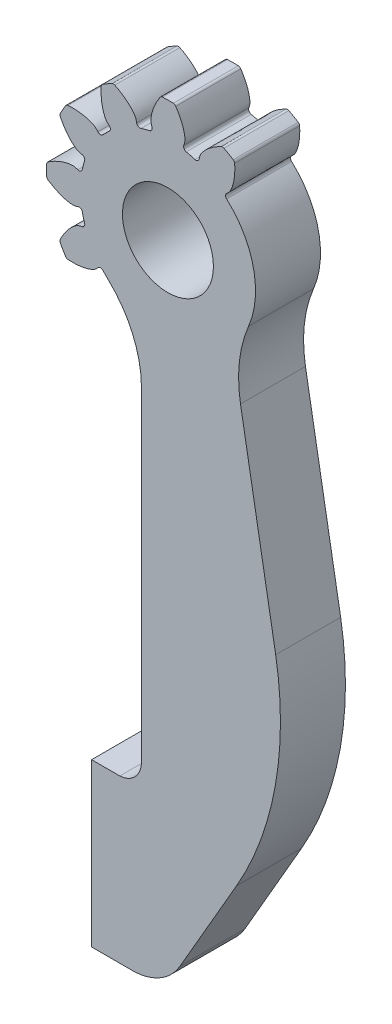
from build123d import *

# Parameters (mm, degrees)
ESQUISSE1_R        = 3.5
BOSS_EXTRU_1_DEPTH = 5


with BuildPart() as part:
    # Esquisse1 → Boss.-Extru.1 (new body)
    with BuildSketch(Plane.XY):
        with BuildLine():
            Line((5.90749079, 12.326495986), (8.616081221, -3.034683677))
            ThreePointArc((8.616081221, -3.034683677), (8.590159921, -11.751121376), (5.60083157, -19.938970549))
            Line((5.60083157, -19.938970549), (1.251100309, -27.472926092))
            ThreePointArc((1.251100309, -27.472926092), (-0.257489724, -28.999497571), (-2.320380522, -29.591735642))
            Line((-2.320380522, -29.591735642), (-5.550979445, -29.591735642))
            Line((-5.550979445, -29.591735642), (-5.550979445, -17.107469849))
            Line((-5.550979445, -17.107469849), (-3.378672956, -17.107469849))
            ThreePointArc((-3.378672956, -17.107469849), (-2.198535402, -16.559306042), (-1.717510344, -15.350247276))
            Line((-1.717510344, -15.350247276), (-1.717510344, 9.701342702))
            ThreePointArc((-1.717510344, 9.701342702), (-2.406894368, 12.879278297), (-4.28656883, 15.53283231))
            ThreePointArc((-4.28656883, 15.53283231), (-4.487711645, 15.729441192), (-4.68047629, 15.934271064))
            ThreePointArc((-4.68047629, 15.934271064), (-4.876370075, 16.017987907), (-5.067106513, 15.923106423))
            add(Edge.make_bspline(
                [(-5.067106513, 15.923106423), (-5.191748055, 15.767851436), (-5.299939447, 15.691192227), (-5.475656017, 15.590422708), (-5.555626682, 15.558374213), (-5.713073438, 15.497624167), (-5.788388923, 15.47301413), (-6.0298478, 15.402875582), (-6.188098951, 15.371946944), (-6.497686976, 15.326706478), (-6.647693738, 15.313871913), (-6.988957126, 15.299473797), (-7.17803548, 15.303219532), (-7.36420262, 15.315613466)],
                knots=[0, 0, 0, 0, 0.081187854, 0.081187854, 0.177126146, 0.177126146, 0.273064439, 0.273064439, 0.491378603, 0.491378603, 0.709692767, 0.709692767, 1, 1, 1, 1], degree=3))
            ThreePointArc((-7.36420262, 15.315613466), (-7.470552259, 15.348577609), (-7.550581738, 15.42598667))
            ThreePointArc((-7.550581738, 15.42598667), (-7.7655753, 15.779999439), (-7.96466262, 16.143195682))
            ThreePointArc((-7.96466262, 16.143195682), (-7.991686109, 16.251207764), (-7.967059097, 16.359791322))
            add(Edge.make_bspline(
                [(-7.967059097, 16.359791322), (-7.853279142, 16.591112501), (-7.721655826, 16.819817791), (-7.510149499, 17.119807091), (-7.454888608, 17.193639283), (-7.275603496, 17.41549623), (-7.144423881, 17.560666055), (-6.923836208, 17.748089252), (-6.871808058, 17.790229571), (-6.766452318, 17.865003383), (-6.719211083, 17.897766079), (-6.592860612, 17.966193375), (-6.508136026, 18.001557991), (-6.358828318, 18.034124778), (-6.326776228, 18.040093733), (-6.292406937, 18.045388672)],
                knots=[0, 0, 0, 0, 0.401379627, 0.401379627, 0.532597128, 0.532597128, 0.79503213, 0.79503213, 0.872293173, 0.872293173, 0.929035384, 0.929035384, 0.985777595, 0.985777595, 1, 1, 1, 1], degree=3))
            ThreePointArc((-6.292406937, 18.045388672), (-6.114868959, 18.163130556), (-6.089423008, 18.374637975))
            ThreePointArc((-6.089423008, 18.374637975), (-6.187238301, 18.705559184), (-6.267988424, 19.041052993))
            ThreePointArc((-6.267988424, 19.041052993), (-6.395778997, 19.211500799), (-6.608402339, 19.224699243))
            add(Edge.make_bspline(
                [(-6.608402339, 19.224699243), (-6.793972575, 19.152565251), (-6.925998674, 19.140272125), (-7.128558447, 19.140861446), (-7.213839323, 19.153091968), (-7.380567237, 19.179204263), (-7.458097378, 19.195549088), (-7.702276169, 19.255536761), (-7.85479, 19.307877348), (-8.145521318, 19.423491963), (-8.281848263, 19.487380282), (-8.58459009, 19.645542843), (-8.746463889, 19.743325926), (-8.901492413, 19.84714297)],
                knots=[0, 0, 0, 0, 0.081187854, 0.081187854, 0.177126147, 0.177126147, 0.27306444, 0.27306444, 0.491378597, 0.491378597, 0.709692753, 0.709692753, 1, 1, 1, 1], degree=3))
            ThreePointArc((-8.901492413, 19.84714297), (-8.977111822, 19.928865573), (-9.007714851, 20.035918521))
            ThreePointArc((-9.007714851, 20.035918521), (-9.016898352, 20.449999352), (-9.007714908, 20.864080185))
            ThreePointArc((-9.007714908, 20.864080185), (-8.977111894, 20.971133137), (-8.901492497, 21.05285575))
            add(Edge.make_bspline(
                [(-8.901492497, 21.05285575), (-8.687295576, 21.196295791), (-8.458953794, 21.328548725), (-8.125789291, 21.482593915), (-8.04101586, 21.518904025), (-7.774821925, 21.621395219), (-7.588632133, 21.681526168), (-7.303886006, 21.733545582), (-7.237758148, 21.744026093), (-7.109130488, 21.756104245), (-7.051837025, 21.760856956), (-6.908200633, 21.756941491), (-6.817144663, 21.745205847), (-6.671557002, 21.698755648), (-6.640814628, 21.687898878), (-6.608402509, 21.675299796)],
                knots=[0, 0, 0, 0, 0.401379628, 0.401379628, 0.532597129, 0.532597129, 0.795032131, 0.795032131, 0.872293174, 0.872293174, 0.929035391, 0.929035391, 0.985777608, 0.985777608, 1, 1, 1, 1], degree=3))
            ThreePointArc((-6.608402509, 21.675299796), (-6.395779169, 21.68849827), (-6.267988619, 21.858946092))
            ThreePointArc((-6.267988619, 21.858946092), (-6.187238542, 22.194439913), (-6.089423296, 22.525361136))
            ThreePointArc((-6.089423296, 22.525361136), (-6.114869276, 22.736868551), (-6.29240727, 22.85461041))
            add(Edge.make_bspline(
                [(-6.29240727, 22.85461041), (-6.489182804, 22.884925658), (-6.609667322, 22.940292548), (-6.784794571, 23.042082802), (-6.852534713, 23.095315181), (-6.983869174, 23.201293048), (-7.042839833, 23.254213152), (-7.22431103, 23.428253393), (-7.330221587, 23.549838585), (-7.524194984, 23.795329432), (-7.610313421, 23.91882181), (-7.793414258, 24.207165522), (-7.884709542, 24.372785062), (-7.967059664, 24.540207528)],
                knots=[0, 0, 0, 0, 0.081187854, 0.081187854, 0.177126145, 0.177126145, 0.273064437, 0.273064437, 0.49137859, 0.49137859, 0.709692742, 0.709692742, 1, 1, 1, 1], degree=3))
            ThreePointArc((-7.967059664, 24.540207528), (-7.991686691, 24.648791083), (-7.964663218, 24.756803169))
            ThreePointArc((-7.964663218, 24.756803169), (-7.765575947, 25.119999439), (-7.550582435, 25.474012237))
            ThreePointArc((-7.550582435, 25.474012237), (-7.470552972, 25.551421306), (-7.364203346, 25.584385467))
            add(Edge.make_bspline(
                [(-7.364203346, 25.584385467), (-7.106983352, 25.601509726), (-6.843107104, 25.601873235), (-6.477555586, 25.568698032), (-6.385984587, 25.557756794), (-6.104208278, 25.513419805), (-5.912897712, 25.472399838), (-5.640290627, 25.375076909), (-5.577781967, 25.351089369), (-5.460348064, 25.297235523), (-5.408354106, 25.272704758), (-5.285919051, 25.197495651), (-5.212930077, 25.141804283), (-5.110072567, 25.028783389), (-5.088877296, 25.004009986), (-5.067107141, 24.976892829)],
                knots=[0, 0, 0, 0, 0.401379626, 0.401379626, 0.532597127, 0.532597127, 0.79503213, 0.79503213, 0.872293172, 0.872293172, 0.929035397, 0.929035397, 0.985777623, 0.985777623, 1, 1, 1, 1], degree=3))
            ThreePointArc((-5.067107141, 24.976892829), (-4.876370689, 24.882011372), (-4.680476916, 24.965728242))
            ThreePointArc((-4.680476916, 24.965728242), (-4.442798388, 25.215899375), (-4.192627288, 25.453577937))
            ThreePointArc((-4.192627288, 25.453577937), (-4.108910445, 25.649471722), (-4.203791929, 25.840208161))
            add(Edge.make_bspline(
                [(-4.203791929, 25.840208161), (-4.359046916, 25.964849702), (-4.435706125, 26.073041095), (-4.536475644, 26.248757664), (-4.568524139, 26.328728328), (-4.629274184, 26.486175083), (-4.65388422, 26.561490566), (-4.724022771, 26.802949447), (-4.754951409, 26.961200601), (-4.800191875, 27.270788631), (-4.81302644, 27.420795397), (-4.827424555, 27.762058783), (-4.82367882, 27.951137132), (-4.811284886, 28.137304281)],
                knots=[0, 0, 0, 0, 0.081187854, 0.081187854, 0.177126145, 0.177126145, 0.273064437, 0.273064437, 0.491378605, 0.491378605, 0.709692774, 0.709692774, 1, 1, 1, 1], degree=3))
            ThreePointArc((-4.811284886, 28.137304281), (-4.778320739, 28.243653912), (-4.700911682, 28.323683386))
            ThreePointArc((-4.700911682, 28.323683386), (-4.346898913, 28.538676947), (-3.983702671, 28.737764268))
            ThreePointArc((-3.983702671, 28.737764268), (-3.875690588, 28.764787756), (-3.76710703, 28.740160744))
            add(Edge.make_bspline(
                [(-3.76710703, 28.740160744), (-3.535785851, 28.62638079), (-3.307080562, 28.494757474), (-3.007091263, 28.283251147), (-2.93325907, 28.227990257), (-2.711402123, 28.048705144), (-2.566232297, 27.917525528), (-2.3788091, 27.696937856), (-2.336668783, 27.644909707), (-2.261894967, 27.539553963), (-2.229132267, 27.492312725), (-2.160704964, 27.365962233), (-2.125340346, 27.281237633), (-2.092773566, 27.13192992), (-2.086804616, 27.099877851), (-2.08150968, 27.065508585)],
                knots=[0, 0, 0, 0, 0.401379626, 0.401379626, 0.532597128, 0.532597128, 0.79503213, 0.79503213, 0.872293172, 0.872293172, 0.929035389, 0.929035389, 0.985777605, 0.985777605, 1, 1, 1, 1], degree=3))
            ThreePointArc((-2.08150968, 27.065508585), (-1.963767796, 26.887970607), (-1.752260377, 26.862524656))
            ThreePointArc((-1.752260377, 26.862524656), (-1.421339168, 26.960339948), (-1.085845359, 27.041090072))
            ThreePointArc((-1.085845359, 27.041090072), (-0.915397554, 27.168880644), (-0.90219911, 27.381503987))
            add(Edge.make_bspline(
                [(-0.90219911, 27.381503987), (-0.974333102, 27.567074222), (-0.986626228, 27.699100322), (-0.986036906, 27.901660094), (-0.973806385, 27.986940969), (-0.94769409, 28.153668883), (-0.931349264, 28.231199024), (-0.87136159, 28.475377824), (-0.819020999, 28.627891662), (-0.703406377, 28.918622995), (-0.639518053, 29.054949947), (-0.481355494, 29.357691764), (-0.383572418, 29.519565549), (-0.279755382, 29.674594061)],
                knots=[0, 0, 0, 0, 0.081187854, 0.081187854, 0.177126146, 0.177126146, 0.273064439, 0.273064439, 0.491378608, 0.491378608, 0.709692776, 0.709692776, 1, 1, 1, 1], degree=3))
            ThreePointArc((-0.279755382, 29.674594061), (-0.198032779, 29.75021347), (-0.090979831, 29.780816498))
            ThreePointArc((-0.090979831, 29.780816498), (0.323101, 29.79), (0.737181833, 29.780816556))
            ThreePointArc((0.737181833, 29.780816556), (0.844234784, 29.750213542), (0.925957398, 29.674594145))
            add(Edge.make_bspline(
                [(0.925957398, 29.674594145), (1.069397439, 29.460397223), (1.201650373, 29.232055442), (1.355695563, 28.898890939), (1.392005672, 28.814117508), (1.494496867, 28.547923573), (1.554627816, 28.361733781), (1.60664723, 28.076987654), (1.617127741, 28.010859796), (1.629205892, 27.882232135), (1.633958604, 27.824938672), (1.630043139, 27.681302279), (1.618307494, 27.590246309), (1.571857295, 27.444658647), (1.561000525, 27.413916274), (1.548401444, 27.381504157)],
                knots=[0, 0, 0, 0, 0.401379628, 0.401379628, 0.532597129, 0.532597129, 0.795032131, 0.795032131, 0.872293174, 0.872293174, 0.929035391, 0.929035391, 0.985777609, 0.985777609, 1, 1, 1, 1], degree=3))
            ThreePointArc((1.548401444, 27.381504157), (1.561599917, 27.168880816), (1.73204774, 27.041090267))
            ThreePointArc((1.73204774, 27.041090267), (2.06754156, 26.96034019), (2.398462783, 26.862524944))
            ThreePointArc((2.398462783, 26.862524944), (2.609970199, 26.887970924), (2.727712058, 27.065508918))
            add(Edge.make_bspline(
                [(2.727712058, 27.065508918), (2.758027306, 27.262284452), (2.813394197, 27.382768971), (2.915184451, 27.557896221), (2.968416833, 27.625636366), (3.074394702, 27.756970829), (3.127314808, 27.815941489), (3.301355055, 27.997412691), (3.42294025, 28.10332325), (3.668431107, 28.297296652), (3.79192349, 28.383415091), (4.080267195, 28.56651592), (4.245886722, 28.657811196), (4.413309175, 28.740161311)],
                knots=[0, 0, 0, 0, 0.081187854, 0.081187854, 0.177126149, 0.177126149, 0.273064443, 0.273064443, 0.491378604, 0.491378604, 0.709692764, 0.709692764, 1, 1, 1, 1], degree=3))
            ThreePointArc((4.413309175, 28.740161311), (4.52189273, 28.764788339), (4.629904817, 28.737764865))
            ThreePointArc((4.629904817, 28.737764865), (4.993101087, 28.538677595), (5.347113885, 28.323684083))
            ThreePointArc((5.347113885, 28.323684083), (5.424522954, 28.24365462), (5.457487115, 28.137304994))
            add(Edge.make_bspline(
                [(5.457487115, 28.137304994), (5.474611373, 27.880084999), (5.474974883, 27.61620875), (5.44179968, 27.250657233), (5.430858441, 27.159086233), (5.386521453, 26.877309925), (5.345501487, 26.685999361), (5.248178557, 26.413392275), (5.224191016, 26.350883613), (5.170337177, 26.233449726), (5.145806416, 26.181455785), (5.070597355, 26.059020781), (5.014906027, 25.986031839), (4.901885157, 25.883174318), (4.8771117, 25.861978997), (4.849994477, 25.840208789)],
                knots=[0, 0, 0, 0, 0.401379627, 0.401379627, 0.532597128, 0.532597128, 0.79503213, 0.79503213, 0.872293173, 0.872293173, 0.92903538, 0.92903538, 0.985777588, 0.985777588, 1, 1, 1, 1], degree=3))
            ThreePointArc((4.849994477, 25.840208789), (4.75511302, 25.649472337), (4.83882989, 25.453578564))
            ThreePointArc((4.83882989, 25.453578564), (6.903298268, 21.908976505), (6.530483487, 17.823974353))
            ThreePointArc((6.530483487, 17.823974353), (5.821287087, 15.120303874), (5.90749079, 12.326495986))
        make_face()
        with Locations((0.323101648, 20.45)):
            Circle(ESQUISSE1_R, mode=Mode.SUBTRACT)
    extrude(amount=BOSS_EXTRU_1_DEPTH)


solid = part.part
